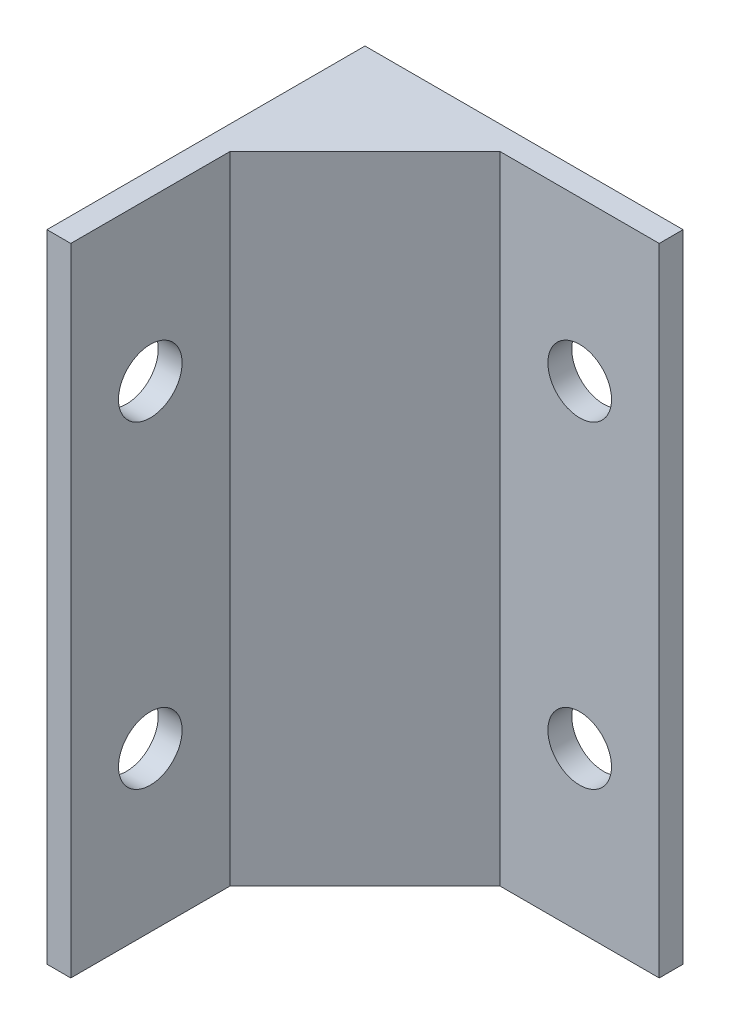
from build123d import *

# Parameters (mm, degrees)
SZKIC1_W                        = 40
SZKIC1_H                        = 40
DODANIE_WYCI_GNI_CIE1_DEPTH     = 80
WYTNIJ_WYCI_GNI_CIE2_DEPTH      = 85.852813742
WYTNIJ_WYCI_GNI_CIE2_DEPTH_BACK = 80
SZKIC3_R                        = 4
WYTNIJ_WYCI_GNI_CIE3_DEPTH      = 91.382520434


with BuildPart() as part:
    # Szkic1 → Dodanie-wyciągnięcie1 (new body)
    with BuildSketch(Plane(origin=(0, 0, 0), x_dir=(1, 0, 0), z_dir=(0, 1, 0))):
        Rectangle(SZKIC1_W, SZKIC1_H)
    extrude(amount=DODANIE_WYCI_GNI_CIE1_DEPTH)

    # Szkic2 → Wytnij-wyciągnięcie2 (cut, two sides: drawn at the far end of the back side and taken through both)
    with BuildSketch(Plane(origin=(0, 80, 0), x_dir=(1, 0, 0), z_dir=(0, 1, 0)).offset(-WYTNIJ_WYCI_GNI_CIE2_DEPTH_BACK)):
        Polygon((-17, 0), (-17, -20), (20, -20), (20, 17), (0, 17), align=None)
    extrude(amount=WYTNIJ_WYCI_GNI_CIE2_DEPTH + WYTNIJ_WYCI_GNI_CIE2_DEPTH_BACK, mode=Mode.SUBTRACT)

    # Szkic3 → Wytnij-wyciągnięcie3 (cut, through all)
    with BuildSketch(Plane.XY.offset(-17)):
        with Locations((10, 60)):
            Circle(SZKIC3_R)
        with Locations(Location((10, 20, 0), (0, 0, 180))):
            Circle(SZKIC3_R)
    wytnij_wyci_gni_cie3 = extrude(amount=-WYTNIJ_WYCI_GNI_CIE3_DEPTH, mode=Mode.SUBTRACT)

    # Lustro1: Wytnij-wyciągnięcie3 across plane
    add(wytnij_wyci_gni_cie3.mirror(Plane(origin=(0, 0, 0), x_dir=(0.7071067811865476, 0, 0.7071067811865475), z_dir=(-0.7071067811865475, 0, 0.7071067811865476))), mode=Mode.SUBTRACT)


solid = part.part
